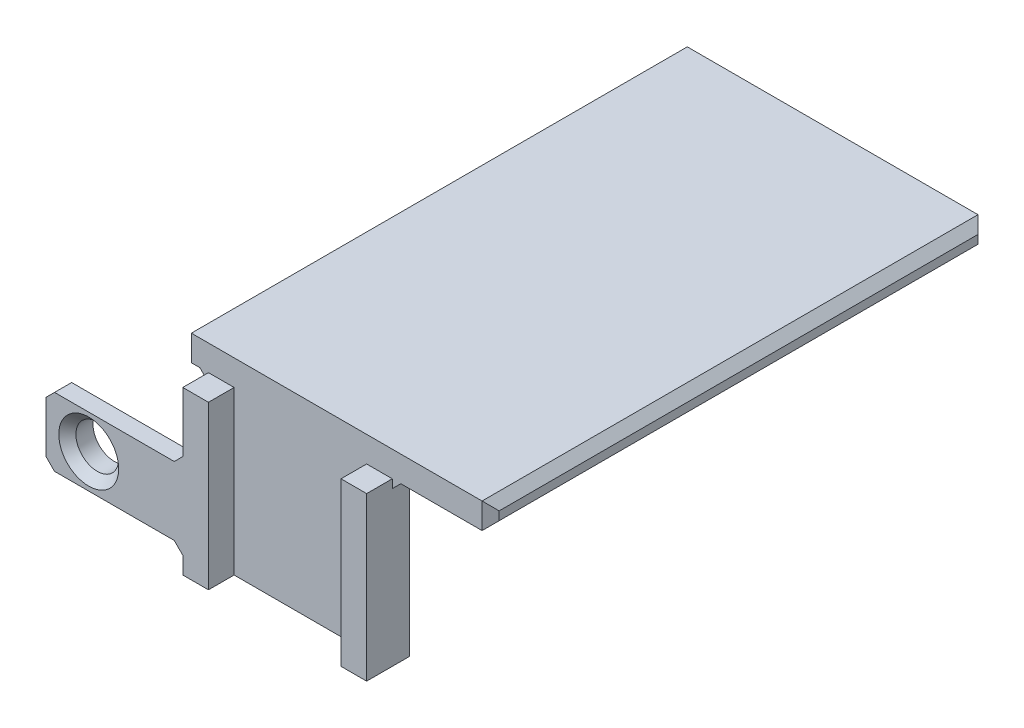
from build123d import *

# Parameters (mm, degrees)
EXTRUDE_1_DEPTH = 20
SKETCH_2_W      = 16
SKETCH_2_H      = 8
SKETCH_2_R      = 2.502951076
EXTRUDE_2_DEPTH = 3
EXTRUDE_START   = -3
SKETCH_3_W      = 36
SKETCH_3_H      = 3
EXTRUDE_3_DEPTH = 58
CHAMFER_1_SIZE  = 1


with BuildPart() as part:
    # 草图1 → 凸台-拉伸1 (new body)
    with BuildSketch(Plane(origin=(0, 0, 0), x_dir=(1, 0, 0), z_dir=(0, 1, 0))):
        Polygon((-3, 3), (18.5, 3), (18.5, -3), (15.5, -3), (15.5, 0), (0, 0), (0, -3), (-3, -3), align=None)
    extrude(amount=EXTRUDE_1_DEPTH)

    # 草图2 → 凸台-拉伸2 (add)
    with BuildSketch(Plane.XY.offset(3)):
        with Locations((-11, 8)):
            Rectangle(SKETCH_2_W, SKETCH_2_H)
        with Locations((-14.001123559, 8.002728821)):
            Circle(SKETCH_2_R, mode=Mode.SUBTRACT)
    extrude(amount=-EXTRUDE_2_DEPTH)

    # 草图3 → 凸台-拉伸3 (add)
    with BuildSketch(Plane(origin=(0, 0, -3), x_dir=(-1, 0, 0), z_dir=(0, 0, -1)).offset(EXTRUDE_START)):
        with Locations((-12, 21.5)):
            Rectangle(SKETCH_3_W, SKETCH_3_H)
    extrude(amount=EXTRUDE_3_DEPTH)

    # 倒角1
    chamfer_1_edges = [part.edges().sort_by_distance(p)[0] for p in [
        (30, 23, -29),
        (30, 21.5, -58),
        (30, 20, -29),
        (30, 21.5, 0),
        (-6, 20, -29),
        (-6, 21.5, -58),
        (-6, 23, -29),
        (-6, 21.5, 0),
        (-16.504074634, 8.002728821, 3),
        (-3, 4, 1.5),
        (-3, 12, 1.5),
        (-19, 12, 1.5),
        (-19, 4, 1.5),
        (-19, 8, 0),
        (-11, 4, 0),
        (-11, 12, 0),
        (-3, 8, 0),
        (-3, 20, -1.5),
        (18.5, 20, -1.5),
        (7.75, 0, 0),
        (15.5, 0, 1.5),
        (17, 0, 3),
        (18.5, 0, 0),
        (7.75, 0, -3),
        (0, 0, 1.5),
        (-1.5, 0, 3),
        (-3, 0, 0),
        (-3, 10, -3),
        (18.5, 10, -3),
        (7.75, 20, -3),
    ]]
    chamfer(chamfer_1_edges, length=CHAMFER_1_SIZE)


solid = part.part
